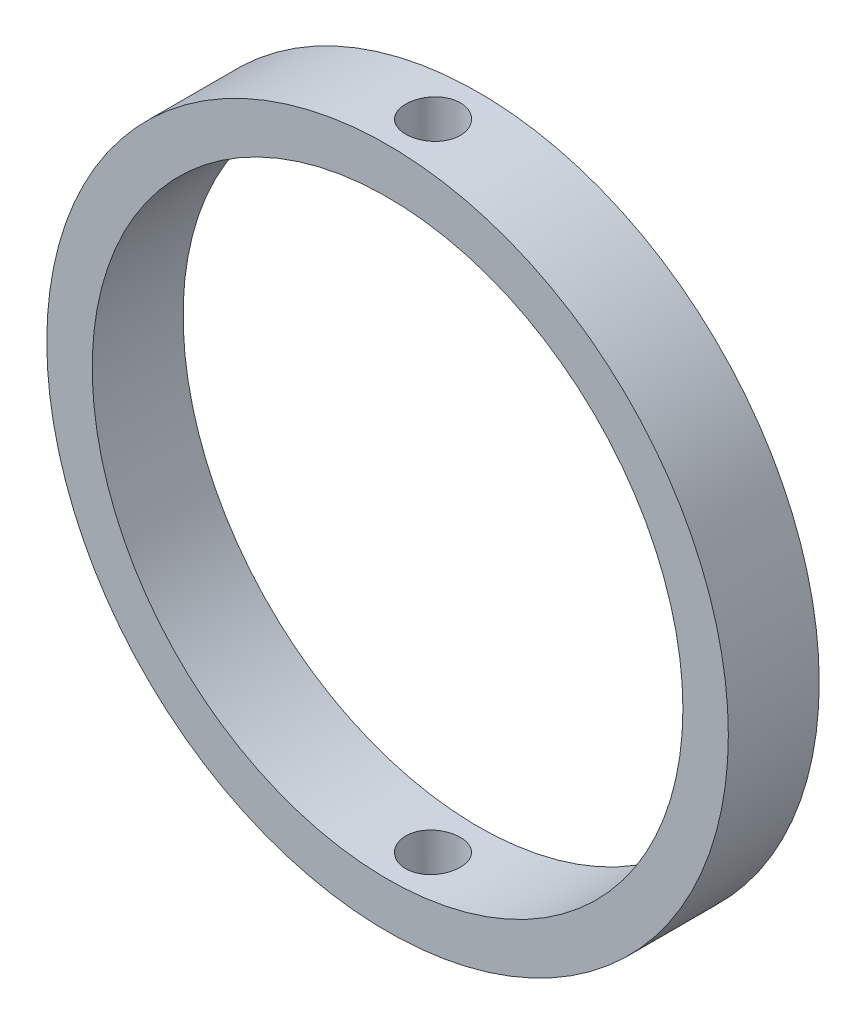
from build123d import *

# Parameters (mm, degrees)
SKETCH1_R               = 47.625
SKETCH1_R_2             = 41.275
BOSS_EXTRUDE1_DEPTH     = 12.7
CUT_EXTRUDE1_REACH      = 109.247
CUT_EXTRUDE1_END_RADIUS = 41.275
SKETCH2_R               = 3.81


with BuildPart() as part:
    # Sketch1 → Boss-Extrude1 (new body)
    with BuildSketch(Plane.XY):
        Circle(SKETCH1_R)
        Circle(SKETCH1_R_2, mode=Mode.SUBTRACT)
    extrude(amount=BOSS_EXTRUDE1_DEPTH)

    # Cut-Extrude1: up to this cylinder (the profile starts outside it)
    cut_extrude1_end = Plane(origin=(0, 0, 6.35), z_dir=(0, 0, -1)) * Cylinder(CUT_EXTRUDE1_END_RADIUS, 302.044, mode=Mode.PRIVATE)
    # Sketch2 → Cut-Extrude1 (cut, up to the surface)
    with BuildSketch(Plane(origin=(0, 47.625, 0), x_dir=(1, 0, 0), z_dir=(0, 1, 0)), mode=Mode.PRIVATE) as cut_extrude1_sk1:
        with Locations(Location((0, -6.35, 0), (0, 0, 270))):
            Circle(SKETCH2_R)
    cut_extrude1_tool1 = extrude(cut_extrude1_sk1.sketch, amount=-CUT_EXTRUDE1_REACH, mode=Mode.PRIVATE) - cut_extrude1_end
    cut_extrude1 = cut_extrude1_tool1.solids().sort_by_distance((0, 47.625, 6.35))[0]
    add(cut_extrude1, mode=Mode.SUBTRACT)

    # Mirror1: Cut-Extrude1 across plane
    add(cut_extrude1.mirror(Plane.ZX), mode=Mode.SUBTRACT)


solid = part.part
